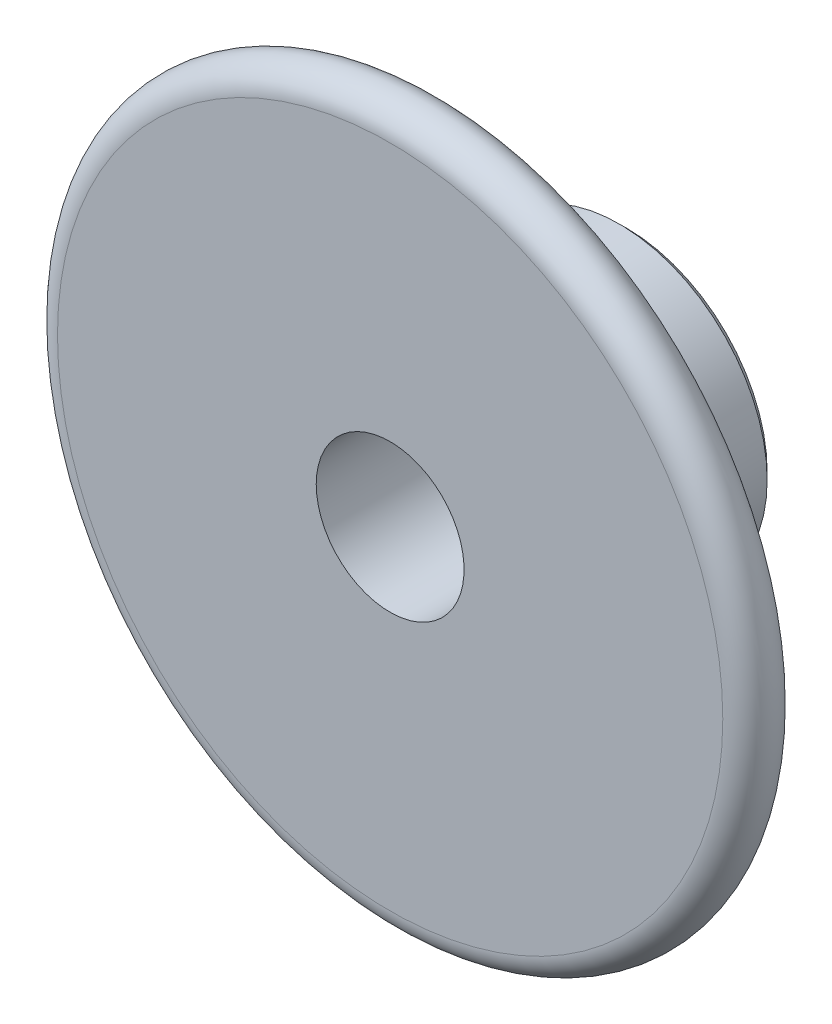
from build123d import *

# Parameters (mm, degrees)
SKETCH_1_R               = 10
EXTRUDE_1_DEPTH          = 12.5
SKETCH_2_R               = 22.5
EXTRUDE_2_DEPTH          = 3.5
SKETCH_4_R               = 5
CUT_EXTRUDE_3_DEPTH      = 36.616007637
SKETCH_5_W               = 1.65
SKETCH_5_H               = 24.25
CHAMFER_2_SIZE           = 0.5
SKETCH_3_R               = 1.75
PATTERN_CIRCULAR_1_COUNT = 2
PATTERN_CIRCULAR_1_ANGLE = 90


with BuildPart() as part:
    # 草图1 → 拉伸1 (new body)
    with BuildSketch(Plane.XY):
        Circle(SKETCH_1_R)
    extrude(amount=EXTRUDE_1_DEPTH)

    # 草图2 → 拉伸2 (add)
    with BuildSketch(Plane.XY.offset(12.5)):
        Circle(SKETCH_2_R)
    extrude(amount=EXTRUDE_2_DEPTH)

    # 草图4 → 拉伸3 (cut, through all)
    with BuildSketch(Plane(origin=(0, 0, 0), x_dir=(-1, 0, 0), z_dir=(0, 0, -1))):
        Circle(SKETCH_4_R)
    extrude(amount=-CUT_EXTRUDE_3_DEPTH, mode=Mode.SUBTRACT)

    # 草图5 → M4 螺纹孔1 (revolve, cut)
    with BuildSketch(Plane(origin=(0, 0, 6), x_dir=(0, 0, -1), z_dir=(1, 0, 0))):
        with Locations((0.825, 12.125)):
            Rectangle(SKETCH_5_W, SKETCH_5_H)
    hole_wizard_m4_1 = revolve(axis=Axis((0, -6.35, 6), (0, 1, 0)), mode=Mode.SUBTRACT)

    # 倒角2
    chamfer_2_edges = [part.edges().sort_by_distance(p)[0] for p in [
        (5, 0, 0),
        (-10, 0, 0),
    ]]
    chamfer(chamfer_2_edges, length=CHAMFER_2_SIZE)

    # 草图3 → 旋转1 (revolve)
    with BuildSketch(Plane(origin=(0, 0, 0), x_dir=(1, 0, 0), z_dir=(0, 1, 0)), mode=Mode.PRIVATE) as revolve_1_sk:
        with Locations((-22.5, -14.25)):
            Circle(SKETCH_3_R)
    revolve(revolve_1_sk.sketch.rotate(Axis((0, 0, 12.5), (0, 0, -1)), 180), axis=Axis((0, 0, 12.5), (0, 0, -1)))

    # 阵列(圆周)1: M4 螺纹孔1 ×2 about axis
    pattern_circular_1_axis = Axis((0, 0, 12.5), (0, 0, -1))
    for i in range(1, PATTERN_CIRCULAR_1_COUNT):
        add(hole_wizard_m4_1.rotate(pattern_circular_1_axis, i * PATTERN_CIRCULAR_1_ANGLE / (PATTERN_CIRCULAR_1_COUNT - 1)), mode=Mode.SUBTRACT)


solid = part.part
